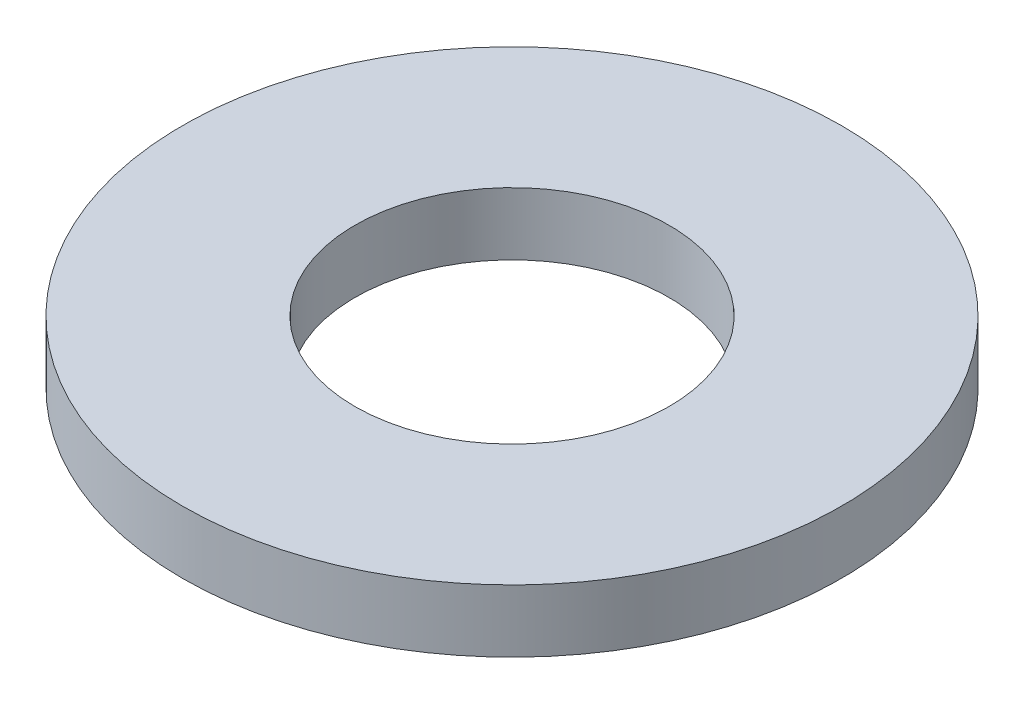
from build123d import *

# Parameters (mm, degrees)
SKETCH1_R           = 5.35
SKETCH1_R_2         = 2.55
BOSS_EXTRUDE1_DEPTH = 1.016


with BuildPart() as part:
    # Sketch1 → Boss-Extrude1 (new body)
    with BuildSketch(Plane(origin=(0, 0, 0), x_dir=(1, 0, 0), z_dir=(0, 1, 0))):
        with Locations(Location((0, 0, 0), (0, 0, 270))):
            Circle(SKETCH1_R)
        with Locations(Location((0, 0, 0), (0, 0, 270))):
            Circle(SKETCH1_R_2, mode=Mode.SUBTRACT)
    extrude(amount=BOSS_EXTRUDE1_DEPTH)


solid = part.part
